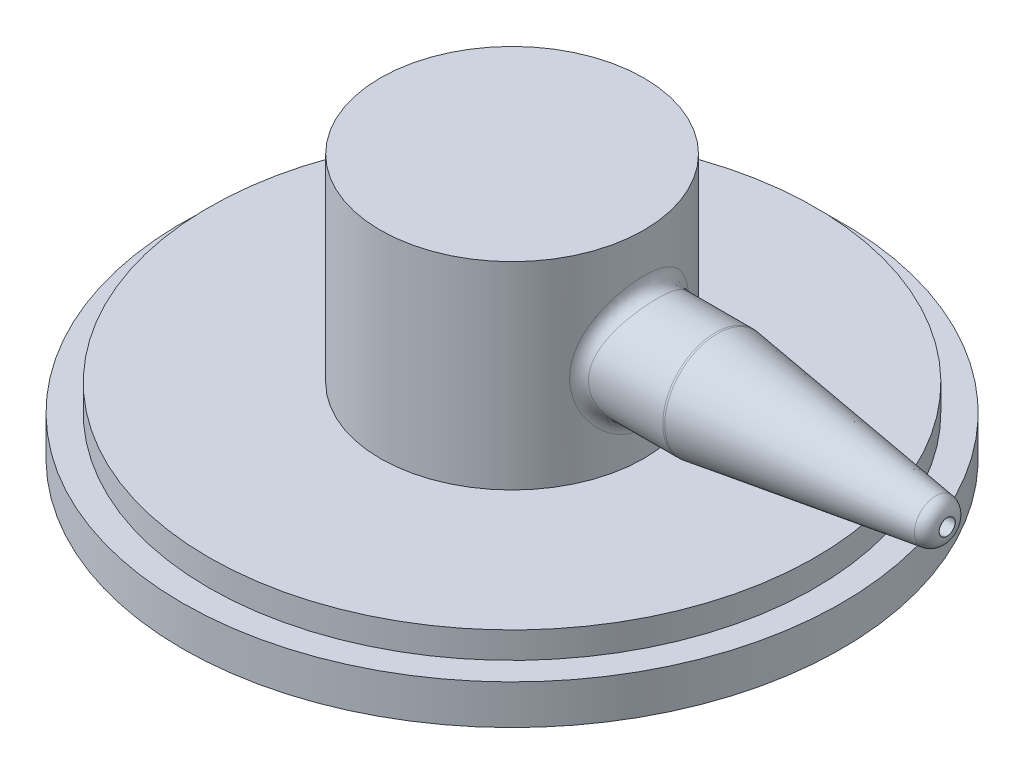
from build123d import *

# Parameters (mm, degrees)
SKETCH3_R               = 4
BOSS_EXTRUDE1_DEPTH     = 25
BOSS_EXTRUDE2_START     = 25
SKETCH3_5_R             = 3
BOSS_EXTRUDE2_DEPTH     = 8
CUT_EXTRUDE1_DEPTH      = 17
CUT_EXTRUDE1_DEPTH_BACK = 46.978255774
SKETCH15_R              = 1.8
FILLET3_R               = 1


with BuildPart() as part:
    # Sketch1 → Revolve1 (revolve)
    with BuildSketch(Plane.XY, mode=Mode.PRIVATE) as revolve1_sk:
        Polygon((0, 20), (0, 0), (25, 0), (25, 3), (23, 3), (23, 5), (10, 5), (10, 20), align=None)
    revolve(revolve1_sk.sketch.rotate(Axis((0, 20, 0), (0, -1, 0)), 90), axis=Axis((0, 20, 0), (0, -1, 0)))

    # Sketch3 → Boss-Extrude1 (add)
    with BuildSketch(Plane(origin=(0, 0, 0), x_dir=(0, 0, -1), z_dir=(1, 0, 0))):
        with Locations(Location((0, 12, 0), (0, 0, 180))):
            Circle(SKETCH3_R)
    extrude(amount=BOSS_EXTRUDE1_DEPTH)

    # Sketch3<5> → Boss-Extrude2 (add)
    with BuildSketch(Plane(origin=(0, 0, 0), x_dir=(0, 0, -1), z_dir=(1, 0, 0)).offset(BOSS_EXTRUDE2_START)):
        with Locations((0, 12)):
            Circle(SKETCH3_5_R)
    extrude(amount=BOSS_EXTRUDE2_DEPTH)

    # Sketch11 → Cut-Revolve10 (revolve, cut)
    with BuildSketch(Plane.XY):
        with BuildLine():
            Line((0, 4), (0, 0))
            Line((0, 0), (22.072872435, 0))
            ThreePointArc((22.072872435, 0), (11.216213299, 2.992049146), (0, 4))
        make_face()
    revolve(axis=Axis((0, 0, 0), (0, 1, 0)), mode=Mode.SUBTRACT)

    # Sketch15 → Cut-Extrude1 (cut, two sides: drawn at the far end of the back side and taken through both)
    with BuildSketch(Plane(origin=(0, 0, 0), x_dir=(1, 0, 0), z_dir=(0, 1, 0)).offset(-CUT_EXTRUDE1_DEPTH_BACK)):
        with Locations(Location((0, 0, 0), (0, 0, 270))):
            Circle(SKETCH15_R)
    extrude(amount=CUT_EXTRUDE1_DEPTH + CUT_EXTRUDE1_DEPTH_BACK, mode=Mode.SUBTRACT)

    # Sketch16 → Cut-Revolve12 (revolve, cut)
    with BuildSketch(Plane.XY, mode=Mode.PRIVATE) as cut_revolve12_sk:
        Polygon((33, 15), (33, 13.5), (15.503373698, 16), (33, 16), align=None)
    revolve(cut_revolve12_sk.sketch.rotate(Axis((33, 12, 0), (-1, 0, 0)), 270), axis=Axis((33, 12, 0), (-1, 0, 0)), mode=Mode.SUBTRACT)

    # Sketch17 → Cut-Revolve13 (revolve, cut)
    with BuildSketch(Plane.XY, mode=Mode.PRIVATE) as cut_revolve13_sk:
        Polygon((33, 12.6), (33, 12), (0, 12), (0, 14.8), (15.503373698, 14.8), (30.900404844, 12.6), align=None)
    revolve(cut_revolve13_sk.sketch.rotate(Axis((33, 12, 0), (-1, 0, 0)), 90), axis=Axis((33, 12, 0), (-1, 0, 0)), mode=Mode.SUBTRACT)

    # Fillet3
    fillet3_edges = [part.edges().sort_by_distance(p)[0] for p in [
        (9.16515139, 12, -4),
        (15.503373698, 12, -4),
        (33, 12, -1.5),
    ]]
    fillet(fillet3_edges, radius=FILLET3_R)


solid = part.part
